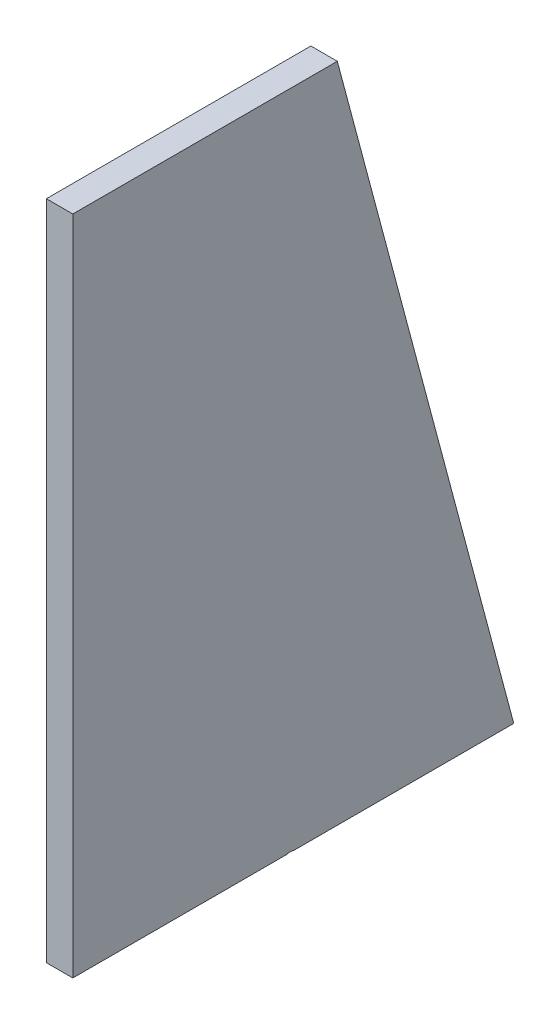
from build123d import *

# Parameters (mm, degrees)
EXTRUDE_1_DEPTH     = 6
BOSS_EXTRUDE4_DEPTH = 0.1


with BuildPart() as part:
    # Эскиз1 → Бобышка-Вытянуть1 (new body)
    with BuildSketch(Plane(origin=(0, 0, 0), x_dir=(0, 0, -1), z_dir=(1, 0, 0))):
        Polygon((0, 0), (100, 0), (60, 150), (0, 150), align=None)
    extrude(amount=EXTRUDE_1_DEPTH)

    # Sketch1 → Boss-Extrude4 (add)
    with BuildSketch(Plane.XZ):
        with BuildLine():
            Line((3, -27.25), (3, 0))
            Line((3, 0), (0, 0))
            Line((0, 0), (0, -48.591302246))
            Line((0, -48.591302246), (0.078671208, -48.591302246))
            Line((0.078671208, -48.591302246), (1.253102949, -28.895833333))
            ThreePointArc((1.253102949, -28.895833333), (1.799956598, -27.726266969), (3, -27.25))
        make_face()
        with BuildLine():
            Line((6, 0), (3, 0))
            Line((3, 0), (3, -27.25))
            ThreePointArc((3, -27.25), (4.200043402, -27.726266969), (4.746897051, -28.895833333))
            Line((4.746897051, -28.895833333), (5.921328792, -48.591302246))
            Line((5.921328792, -48.591302246), (6, -48.591302246))
            Line((6, -48.591302246), (6, 0))
        make_face()
        with BuildLine():
            Line((6, -100), (6, -50))
            ThreePointArc((6, -50), (5.121320344, -52.121320344), (3, -53))
            Line((3, -53), (3, -100))
            Line((3, -100), (6, -100))
        make_face()
        with BuildLine():
            ThreePointArc((3, -53), (0.878679656, -52.121320344), (0, -50))
            Line((0, -50), (0, -100))
            Line((0, -100), (3, -100))
            Line((3, -100), (3, -53))
        make_face()
    extrude(amount=BOSS_EXTRUDE4_DEPTH)


solid = part.part
